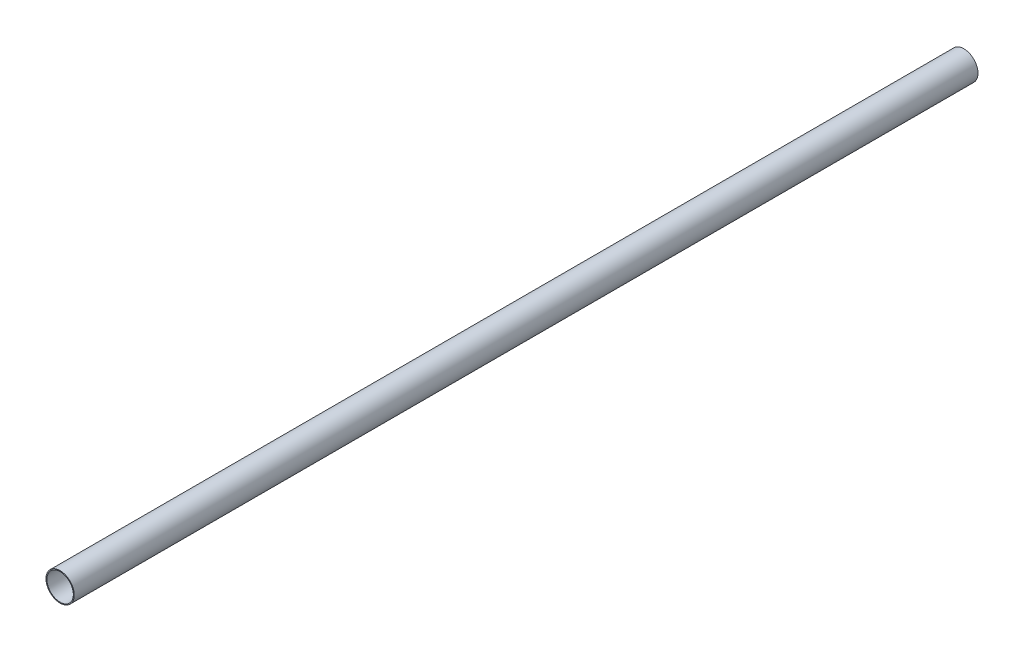
from build123d import *

# Parameters (mm, degrees)
SKETCH2_R           = 14.2875
SKETCH2_R_2         = 13.3985
BOSS_EXTRUDE1_DEPTH = 457.2


with BuildPart() as part:
    # Sketch2 → Boss-Extrude1 (new, symmetric)
    with BuildSketch(Plane.XY):
        Circle(SKETCH2_R)
        Circle(SKETCH2_R_2, mode=Mode.SUBTRACT)
    extrude(amount=BOSS_EXTRUDE1_DEPTH, both=True)


solid = part.part
